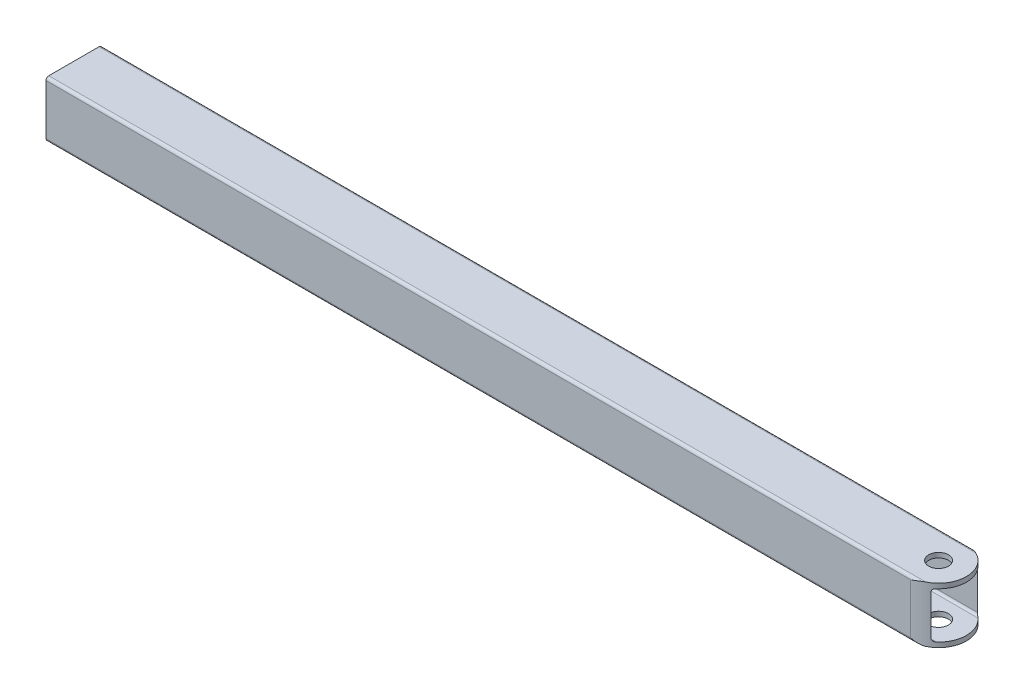
from build123d import *

# Parameters (mm, degrees)
BOSS_EXTRUDE1_DEPTH      = 152.4
BOSS_EXTRUDE1_DEPTH_BACK = 152.4
CUT_EXTRUDE1_DEPTH       = 154.881084364
SKETCH6_R                = 3.3782
CUT_EXTRUDE2_DEPTH       = 154.881084481


with BuildPart() as part:
    # Sketch4 → Boss-Extrude1 (new, two sides: drawn at the far end of the back side and taken through both)
    with BuildSketch(Plane(origin=(0, 0, 0), x_dir=(0, 0, -1), z_dir=(1, 0, 0)).offset(-BOSS_EXTRUDE1_DEPTH_BACK)):
        with BuildLine():
            Line((9.525, -8.5725), (9.525, 8.5725))
            ThreePointArc((9.525, 8.5725), (9.246019209, 9.246019209), (8.5725, 9.525))
            Line((8.5725, 9.525), (-8.5725, 9.525))
            ThreePointArc((-8.5725, 9.525), (-9.246019209, 9.246019209), (-9.525, 8.5725))
            Line((-9.525, 8.5725), (-9.525, -8.5725))
            ThreePointArc((-9.525, -8.5725), (-9.246019209, -9.246019209), (-8.5725, -9.525))
            Line((-8.5725, -9.525), (8.5725, -9.525))
            ThreePointArc((8.5725, -9.525), (9.246019209, -9.246019209), (9.525, -8.5725))
        make_face()
        with BuildLine():
            Line((7.874, 7.0866), (7.874, -7.0866))
            ThreePointArc((7.874, -7.0866), (7.64337588, -7.64337588), (7.0866, -7.874))
            Line((7.0866, -7.874), (-7.0866, -7.874))
            ThreePointArc((-7.0866, -7.874), (-7.64337588, -7.64337588), (-7.874, -7.0866))
            Line((-7.874, -7.0866), (-7.874, 7.0866))
            ThreePointArc((-7.874, 7.0866), (-7.64337588, 7.64337588), (-7.0866, 7.874))
            Line((-7.0866, 7.874), (7.0866, 7.874))
            ThreePointArc((7.0866, 7.874), (7.64337588, 7.64337588), (7.874, 7.0866))
        make_face(mode=Mode.SUBTRACT)
    extrude(amount=BOSS_EXTRUDE1_DEPTH + BOSS_EXTRUDE1_DEPTH_BACK)

    # Sketch5 → Cut-Extrude1 (cut, through all)
    with BuildSketch(Plane.XZ.offset(9.525)):
        with BuildLine():
            Line((152.4, -9.525), (142.875, -9.525))
            ThreePointArc((142.875, -9.525), (152.4, 0), (142.875, 9.525))
            Line((142.875, 9.525), (152.4, 9.525))
            Line((152.4, 9.525), (157.48, 9.525))
            Line((157.48, 9.525), (157.48, -9.525))
            Line((157.48, -9.525), (152.4, -9.525))
        make_face()
    extrude(amount=-CUT_EXTRUDE1_DEPTH, mode=Mode.SUBTRACT)

    # Sketch6 → Cut-Extrude2 (cut, through all)
    with BuildSketch(Plane(origin=(0, 9.525, 0), x_dir=(1, 0, 0), z_dir=(0, 1, 0))):
        with Locations(Location((142.875, 0, 0), (0, 0, 270))):
            Circle(SKETCH6_R)
    extrude(amount=-CUT_EXTRUDE2_DEPTH, mode=Mode.SUBTRACT)


solid = part.part
